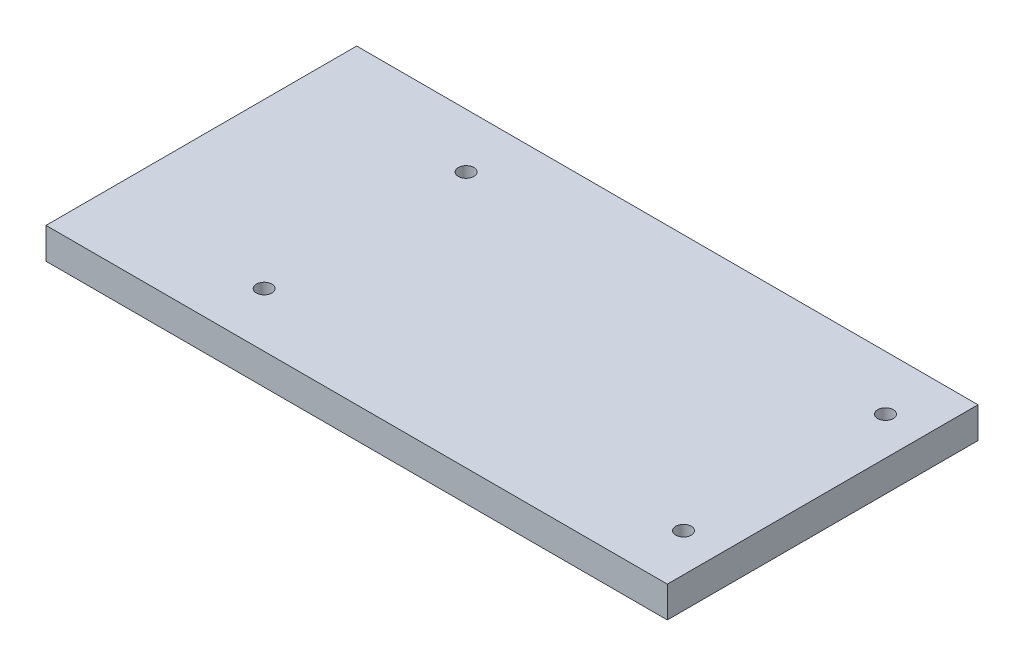
from build123d import *

# Parameters (mm, degrees)
SKETCH1_W           = 200
SKETCH1_H           = 100
BOSS_EXTRUDE1_DEPTH = 10
CUT_EXTRUDE1_REACH  = 114.25
SKETCH2_R           = 2.5


with BuildPart() as part:
    # Sketch1 → Boss-Extrude1 (new body)
    with BuildSketch(Plane(origin=(0, 0, 0), x_dir=(1, 0, 0), z_dir=(0, 1, 0))):
        Rectangle(SKETCH1_W, SKETCH1_H)
    extrude(amount=BOSS_EXTRUDE1_DEPTH)

    # Sketch2 → Cut-Extrude1 (cut, up to next)
    with BuildSketch(Plane(origin=(0, 10, 0), x_dir=(1, 0, 0), z_dir=(0, 1, 0)), mode=Mode.PRIVATE) as cut_extrude1_sk1:
        with Locations(Location((87.72, 32.5, 0), (0, 0, 270))):
            Circle(SKETCH2_R)
    cut_extrude1_tool1 = extrude(cut_extrude1_sk1.sketch, amount=-CUT_EXTRUDE1_REACH, mode=Mode.PRIVATE) & part.part
    # Sketch2 → Cut-Extrude1 (cut, up to next)
    with BuildSketch(Plane(origin=(0, 10, 0), x_dir=(1, 0, 0), z_dir=(0, 1, 0)), mode=Mode.PRIVATE) as cut_extrude1_sk2:
        with Locations(Location((-47.28, 32.5, 0), (0, 0, 270))):
            Circle(SKETCH2_R)
    cut_extrude1_tool2 = extrude(cut_extrude1_sk2.sketch, amount=-CUT_EXTRUDE1_REACH, mode=Mode.PRIVATE) & part.part
    # Sketch2 → Cut-Extrude1 (cut, up to next)
    with BuildSketch(Plane(origin=(0, 10, 0), x_dir=(1, 0, 0), z_dir=(0, 1, 0)), mode=Mode.PRIVATE) as cut_extrude1_sk3:
        with Locations(Location((-47.28, -32.5, 0), (0, 0, 270))):
            Circle(SKETCH2_R)
    cut_extrude1_tool3 = extrude(cut_extrude1_sk3.sketch, amount=-CUT_EXTRUDE1_REACH, mode=Mode.PRIVATE) & part.part
    # Sketch2 → Cut-Extrude1 (cut, up to next)
    with BuildSketch(Plane(origin=(0, 10, 0), x_dir=(1, 0, 0), z_dir=(0, 1, 0)), mode=Mode.PRIVATE) as cut_extrude1_sk4:
        with Locations(Location((87.72, -32.5, 0), (0, 0, 270))):
            Circle(SKETCH2_R)
    cut_extrude1_tool4 = extrude(cut_extrude1_sk4.sketch, amount=-CUT_EXTRUDE1_REACH, mode=Mode.PRIVATE) & part.part
    add(cut_extrude1_tool1.solids().sort_by_distance((87.72, 10, -32.5))[0], mode=Mode.SUBTRACT)
    add(cut_extrude1_tool2.solids().sort_by_distance((-47.28, 10, -32.5))[0], mode=Mode.SUBTRACT)
    add(cut_extrude1_tool3.solids().sort_by_distance((-47.28, 10, 32.5))[0], mode=Mode.SUBTRACT)
    add(cut_extrude1_tool4.solids().sort_by_distance((87.72, 10, 32.5))[0], mode=Mode.SUBTRACT)


solid = part.part
